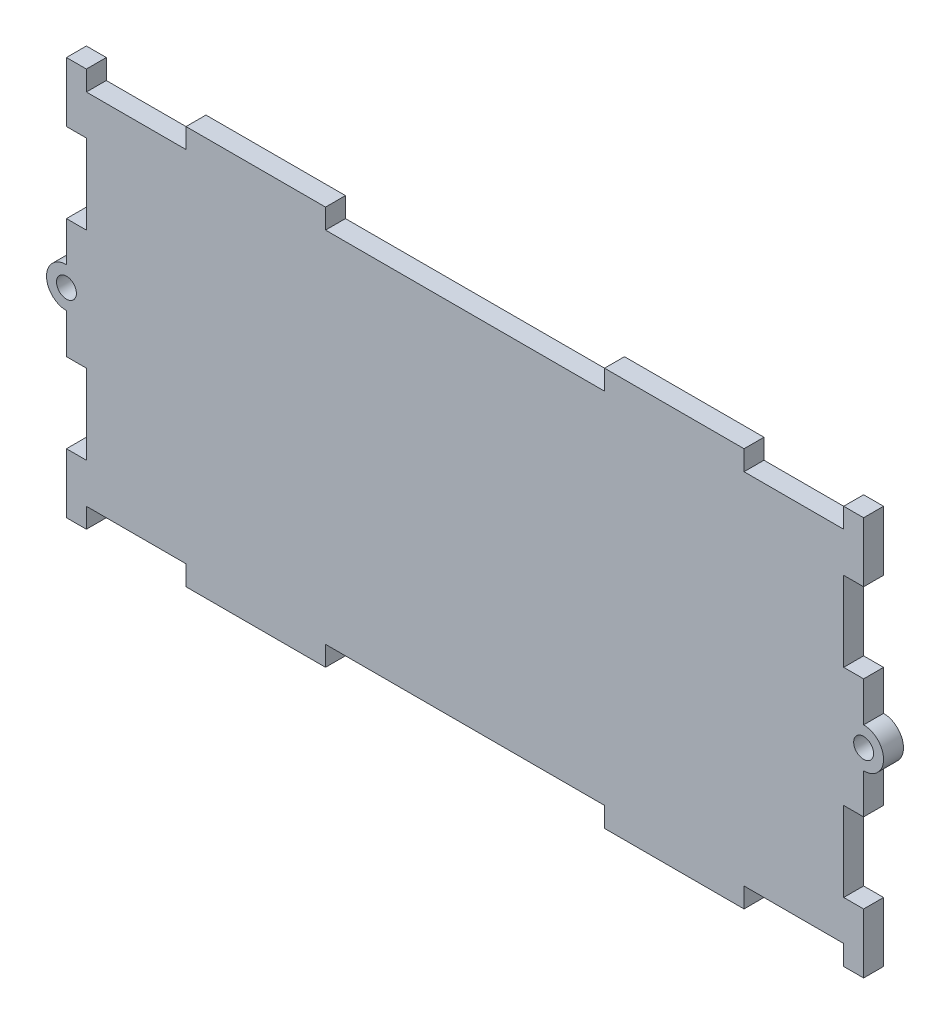
from build123d import *

# Parameters (mm, degrees)
ESQUISSE1_R        = 2.498275285
BOSS_EXTRU_1_DEPTH = 5


with BuildPart() as part:
    # Esquisse1 → Boss.-Extru.1 (new body)
    with BuildSketch(Plane.XY):
        with BuildLine():
            Line((-35, 37.471042471), (35, 37.471042471))
            Line((35, 37.471042471), (35, 42.471042471))
            Line((35, 42.471042471), (70, 42.471042471))
            Line((70, 42.471042471), (70, 37.471042471))
            Line((70, 37.471042471), (95, 37.471042471))
            Line((95, 37.471042471), (95, 42.472767186))
            Line((95, 42.472767186), (100, 42.472767186))
            Line((100, 42.472767186), (100, 37.471042471))
            Line((100, 37.471042471), (100, 27.471042471))
            Line((100, 27.471042471), (95, 27.471042471))
            Line((95, 27.471042471), (95, 7.471042471))
            Line((95, 7.471042471), (100, 7.471042471))
            Line((100, 7.471042471), (100, -2.528957529))
            ThreePointArc((100, -2.528957529), (105, -7.528957529), (100, -12.528957529))
            Line((100, -12.528957529), (100, -22.528957529))
            Line((100, -22.528957529), (95, -22.528957529))
            Line((95, -22.528957529), (95, -42.528957529))
            Line((95, -42.528957529), (100, -42.528957529))
            Line((100, -42.528957529), (100, -52.528957529))
            Line((100, -52.528957529), (100, -57.527232814))
            Line((100, -57.527232814), (95, -57.527232814))
            Line((95, -57.527232814), (95, -52.528957529))
            Line((95, -52.528957529), (70, -52.528957529))
            Line((70, -52.528957529), (70, -57.528957529))
            Line((70, -57.528957529), (35, -57.528957529))
            Line((35, -57.528957529), (35, -52.528957529))
            Line((35, -52.528957529), (-35, -52.528957529))
            Line((-35, -52.528957529), (-35, -57.528957529))
            Line((-35, -57.528957529), (-70, -57.528957529))
            Line((-70, -57.528957529), (-70, -52.528957529))
            Line((-70, -52.528957529), (-95, -52.528957529))
            Line((-95, -52.528957529), (-95, -57.528957529))
            Line((-95, -57.528957529), (-100, -57.528957529))
            Line((-100, -57.528957529), (-100, -52.528957529))
            Line((-100, -52.528957529), (-100, -42.528957529))
            Line((-100, -42.528957529), (-95, -42.528957529))
            Line((-95, -42.528957529), (-95, -22.528957529))
            Line((-95, -22.528957529), (-100, -22.528957529))
            Line((-100, -22.528957529), (-100, -12.528957529))
            ThreePointArc((-100, -12.528957529), (-105, -7.528957529), (-100, -2.528957529))
            Line((-100, -2.528957529), (-100, 7.471042471))
            Line((-100, 7.471042471), (-95, 7.471042471))
            Line((-95, 7.471042471), (-95, 27.471042471))
            Line((-95, 27.471042471), (-100, 27.471042471))
            Line((-100, 27.471042471), (-100, 37.471042471))
            Line((-100, 37.471042471), (-100, 42.471042471))
            Line((-100, 42.471042471), (-95, 42.471042471))
            Line((-95, 42.471042471), (-95, 37.471042471))
            Line((-95, 37.471042471), (-70, 37.471042471))
            Line((-70, 37.471042471), (-70, 42.471042471))
            Line((-70, 42.471042471), (-35, 42.471042471))
            Line((-35, 42.471042471), (-35, 37.471042471))
        make_face()
        with Locations((100, -7.528957529)):
            Circle(ESQUISSE1_R, mode=Mode.SUBTRACT)
        with Locations(Location((-100, -7.528957529, 0), (0, 0, 180))):
            Circle(ESQUISSE1_R, mode=Mode.SUBTRACT)
    extrude(amount=BOSS_EXTRU_1_DEPTH)


solid = part.part
